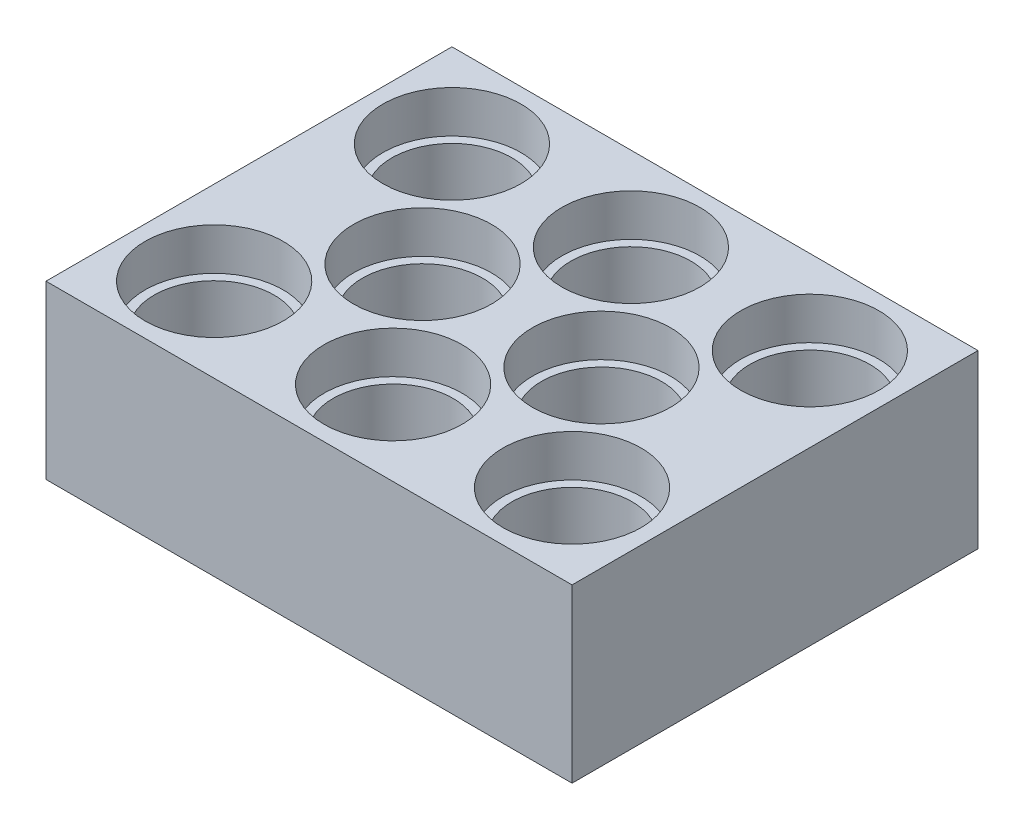
from build123d import *

# Parameters (mm, degrees)
SKETCH_1_W          = 438
SKETCH_1_H          = 338
EXTRUDE_1_DEPTH     = 143
SKETCH_2_R          = 50
CUT_EXTRUDE_1_DEPTH = 135
SKETCH_4_R          = 57.5
CUT_EXTRUDE_2_DEPTH = 35


with BuildPart() as part:
    # Эскиз1 → Бобышка-Вытянуть1 (new body)
    with BuildSketch(Plane(origin=(0, 0, 0), x_dir=(1, 0, 0), z_dir=(0, 1, 0))):
        Rectangle(SKETCH_1_W, SKETCH_1_H)
    extrude(amount=EXTRUDE_1_DEPTH)

    # Эскиз2 → Вырез-Вытянуть1 (cut)
    with BuildSketch(Plane(origin=(0, 143, 0), x_dir=(1, 0, 0), z_dir=(0, 1, 0))):
        with Locations(Location((-149, 99, 0), (0, 0, 270))):
            Circle(SKETCH_2_R)
        with Locations(Location((0, 99, 0), (0, 0, 270))):
            Circle(SKETCH_2_R)
        with Locations(Location((0, -99, 0), (0, 0, 270))):
            Circle(SKETCH_2_R)
        with Locations(Location((-149, -99, 0), (0, 0, 270))):
            Circle(SKETCH_2_R)
        with Locations(Location((-74.5, 0, 0), (0, 0, 270))):
            Circle(SKETCH_2_R)
        with Locations(Location((149, 99, 0), (0, 0, 270))):
            Circle(SKETCH_2_R)
        with Locations(Location((149, -99, 0), (0, 0, 270))):
            Circle(SKETCH_2_R)
        with Locations(Location((74.5, 0, 0), (0, 0, 270))):
            Circle(SKETCH_2_R)
    extrude(amount=-CUT_EXTRUDE_1_DEPTH, mode=Mode.SUBTRACT)

    # Эскиз4 → Вырез-Вытянуть2 (cut)
    with BuildSketch(Plane(origin=(0, 143, 0), x_dir=(1, 0, 0), z_dir=(0, 1, 0))):
        with Locations(Location((-149, 99, 0), (0, 0, 270))):
            Circle(SKETCH_4_R)
        with Locations(Location((0, 99, 0), (0, 0, 270))):
            Circle(SKETCH_4_R)
        with Locations(Location((0, -99, 0), (0, 0, 270))):
            Circle(SKETCH_4_R)
        with Locations(Location((-149, -99, 0), (0, 0, 270))):
            Circle(SKETCH_4_R)
        with Locations(Location((-74.5, 0, 0), (0, 0, 270))):
            Circle(SKETCH_4_R)
        with Locations(Location((149, 99, 0), (0, 0, 270))):
            Circle(SKETCH_4_R)
        with Locations(Location((149, -99, 0), (0, 0, 270))):
            Circle(SKETCH_4_R)
        with Locations(Location((74.5, 0, 0), (0, 0, 270))):
            Circle(SKETCH_4_R)
    extrude(amount=-CUT_EXTRUDE_2_DEPTH, mode=Mode.SUBTRACT)


solid = part.part
